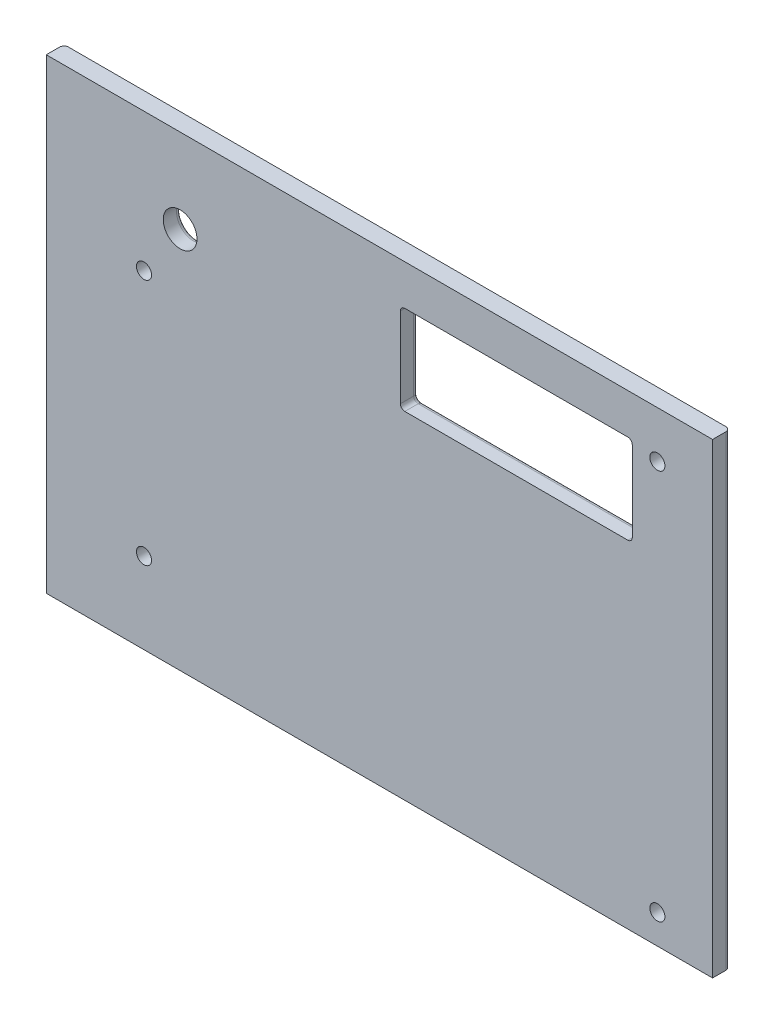
from build123d import *

# Parameters (mm, degrees)
SKETCH1_W                     = 150
SKETCH1_H                     = 105
BOSS_EXTRUDE1_DEPTH           = 2
M3_CLEARANCE_HOLE1_AT_2_COUNT = 2
M3_CLEARANCE_HOLE1_AT_2_PITCH = 55.63
M3_CLEARANCE_HOLE1_AT_3_COUNT = 2
M3_CLEARANCE_HOLE1_AT_3_PITCH = 133.742517548
M3_CLEARANCE_HOLE1_AT_4_COUNT = 2
M3_CLEARANCE_HOLE1_AT_4_PITCH = 117.386327142
M7_CLEARANCE_HOLE1_D          = 7.6
SKETCH6_W                     = 52.2
SKETCH6_H                     = 20.1
CUT_EXTRUDE1_DEPTH            = 10
FILLET1_R                     = 1
FILLET2_R                     = 1
FILLET3_R                     = 1


with BuildPart() as part:
    # Sketch1 → Boss-Extrude1 (new, symmetric)
    with BuildSketch(Plane.XY):
        Rectangle(SKETCH1_W, SKETCH1_H)
    extrude(amount=BOSS_EXTRUDE1_DEPTH, both=True)

    # Sketch3 → M3 Clearance Hole1 (revolve, cut)
    with BuildSketch(Plane(origin=(-53, 21.4, 2), x_dir=(0, -1, 0), z_dir=(1, 0, 0))):
        Polygon((0, 0), (0, 4), (3.3, 4), (1.7, 2.4), (1.7, 0), align=None)
    m3_clearance_hole1 = revolve(axis=Axis((-53, 21.4, 8.35), (0, 0, -1)), mode=Mode.SUBTRACT)

    # M3 Clearance Hole1 at 2: M3 Clearance Hole1 ×2
    with Locations(*[(0, -i * M3_CLEARANCE_HOLE1_AT_2_PITCH, 0) for i in range(1, M3_CLEARANCE_HOLE1_AT_2_COUNT)]):
        add(m3_clearance_hole1, mode=Mode.SUBTRACT)

    # M3 Clearance Hole1 at 3: M3 Clearance Hole1 ×2
    with Locations(*[Vector(0.8641231084854607, -0.5032804917552683, 0) * (i * M3_CLEARANCE_HOLE1_AT_3_PITCH) for i in range(1, M3_CLEARANCE_HOLE1_AT_3_COUNT)]):
        add(m3_clearance_hole1, mode=Mode.SUBTRACT)

    # M3 Clearance Hole1 at 4: M3 Clearance Hole1 ×2
    with Locations(*[Vector(0.9845269275673837, 0.17523335554262423, 0) * (i * M3_CLEARANCE_HOLE1_AT_4_PITCH) for i in range(1, M3_CLEARANCE_HOLE1_AT_4_COUNT)]):
        add(m3_clearance_hole1, mode=Mode.SUBTRACT)

    # M7 Clearance Hole1 (through all)
    with Locations(Plane.XY.offset(2)):
        with Locations((-44.87, 33.54)):
            Hole(M7_CLEARANCE_HOLE1_D / 2)

    # Sketch6 → Cut-Extrude1 (cut)
    with BuildSketch(Plane.XY.offset(2)):
        with Locations((30.82, 33.37)):
            Rectangle(SKETCH6_W, SKETCH6_H)
    extrude(amount=-CUT_EXTRUDE1_DEPTH, mode=Mode.SUBTRACT)

    # Fillet1
    fillet1_edges = [part.edges().sort_by_distance(p)[0] for p in [
        (56.92, 33.37, -2),
        (30.82, 43.42, -2),
        (4.72, 33.37, -2),
        (30.82, 23.32, -2),
        (56.92, 23.32, 0),
        (4.72, 23.32, 0),
        (4.72, 43.42, 0),
        (56.92, 43.42, 0),
    ]]
    fillet(fillet1_edges, radius=FILLET1_R)

    # Fillet2
    fillet2_edges = [part.edges().sort_by_distance(p)[0] for p in [
        (-41.07, 33.54, -2),
    ]]
    fillet(fillet2_edges, radius=FILLET2_R)

    # Fillet3
    fillet3_edges = [part.edges().sort_by_distance(p)[0] for p in [
        (75, 0, -2),
        (-75, 0, -2),
    ]]
    fillet(fillet3_edges, radius=FILLET3_R)


solid = part.part
